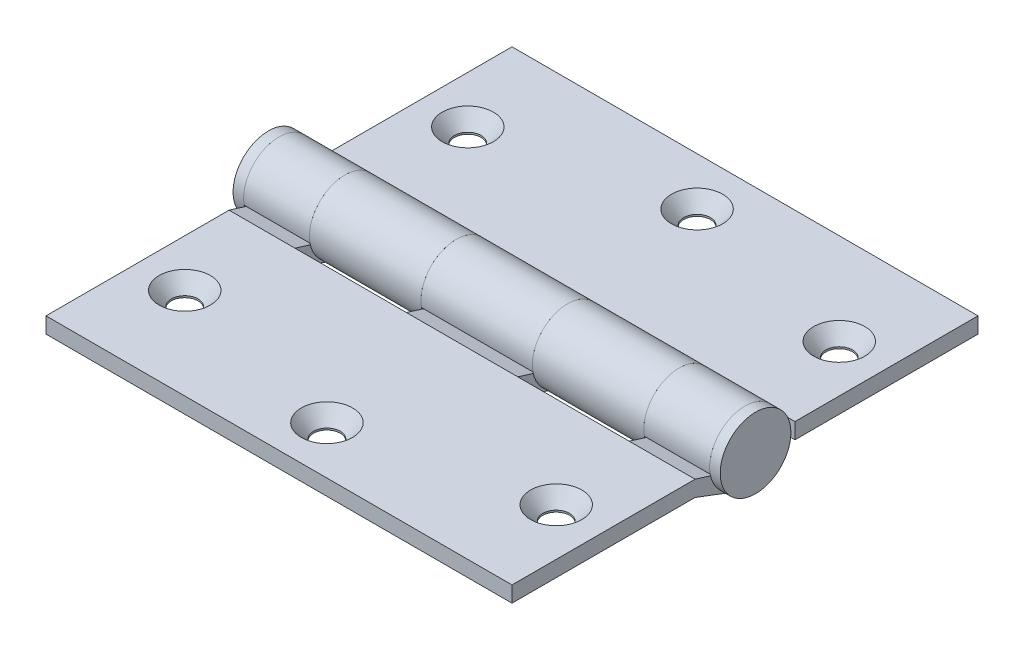
from build123d import *

# Parameters (mm, degrees)
LEFT_LEAF_DEPTH                              = 44.45
CUT_EXTRUDE1_DEPTH                           = 64.222822796
CUT_EXTRUDE1_DEPTH_BACK                      = 64.222822796
SKETCH2_W                                    = 21.2598
SKETCH2_H                                    = 16.271875
RIGHT_LEAF_DEPTH                             = 21.2598
EXTRUDE3_START                               = -44.45
SKETCH4_W                                    = 34.925
SKETCH4_H                                    = 3.0226
EXTRUDE3_DEPTH                               = 88.9
SKETCH6_W                                    = 88.9
SKETCH6_H                                    = 3.3734375
SKETCH7_W                                    = 2.015066667
SKETCH7_H                                    = 6.746875
CSK_FOR_10_FLAT_HEAD_MACHINE_SCREW1_AT_COUNT = 2
CSK_FOR_10_FLAT_HEAD_MACHINE_SCREW1_AT_PITCH = 54.0004
CSK_FOR_10_FLAT_HEAD_MACHINE_SCREW1_2_COUNT  = 2
CSK_FOR_10_FLAT_HEAD_MACHINE_SCREW1_2_PITCH  = 89.0956405
CSK_FOR_10_FLAT_HEAD_MACHINE_SCREW1_3_COUNT  = 2
CSK_FOR_10_FLAT_HEAD_MACHINE_SCREW1_3_PITCH  = 70.866
CSK_FOR_10_FLAT_HEAD_MACHINE_SCREW1_4_COUNT  = 2
CSK_FOR_10_FLAT_HEAD_MACHINE_SCREW1_4_PITCH  = 71.676774812
CSK_FOR_10_FLAT_HEAD_MACHINE_SCREW1_5_COUNT  = 2
CSK_FOR_10_FLAT_HEAD_MACHINE_SCREW1_5_PITCH  = 36.39345824


with BuildPart() as part:
    # Sketch1 → Left Leaf (new, symmetric)
    with BuildSketch(Plane(origin=(0, 0, 0), x_dir=(0, 0, -1), z_dir=(1, 0, 0))):
        with BuildLine():
            Line((-9.525, -3.6068), (-2.389867117, -6.309426078))
            ThreePointArc((-2.389867117, -6.309426078), (5.183454402, 4.318810338), (-6.637155431, -1.21181271))
            Line((-6.637155431, -1.21181271), (-2.148853245, -2.600482704))
            ThreePointArc((-2.148853245, -2.600482704), (1.603448449, 2.968001624), (-0.997099439, -3.222712099))
            Line((-0.997099439, -3.222712099), (-9.525, -0.5842))
            Line((-9.525, -0.5842), (-44.45, -0.5842))
            Line((-44.45, -0.5842), (-44.45, -3.6068))
            Line((-44.45, -3.6068), (-9.525, -3.6068))
        make_face()
    extrude(amount=LEFT_LEAF_DEPTH, both=True)

    # Sketch2 → Cut-Extrude1 (cut, two sides: drawn at the far end of the back side and taken through both)
    with BuildSketch(Plane(origin=(0, 0, 0), x_dir=(1, 0, 0), z_dir=(0, 1, 0)).offset(-CUT_EXTRUDE1_DEPTH_BACK)):
        with Locations((21.2598, -1.3890625)):
            Rectangle(SKETCH2_W, SKETCH2_H)
        with Locations((-21.2598, -1.3890625)):
            Rectangle(SKETCH2_W, SKETCH2_H)
    extrude(amount=CUT_EXTRUDE1_DEPTH + CUT_EXTRUDE1_DEPTH_BACK, mode=Mode.SUBTRACT)

    # Sketch9 → CSK for #10 Flat Head Machine Screw1 (revolve, cut)
    with BuildSketch(Plane(origin=(-35.433, -0.5842, 27.0002), x_dir=(0, 0, 1), z_dir=(1, 0, 0))):
        Polygon((0, 0), (0, 6.162675), (2.5527, 6.162675), (2.5527, 2.688180894), (4.8895, 0), align=None)
    csk_for_10_flat_head_machine_screw1 = revolve(axis=Axis((-35.433, 5.7658, 27.0002), (0, -1, 0)), mode=Mode.SUBTRACT)

    # CSK for _10 Flat Head Machine Screw1 3: CSK for #10 Flat Head Machine Screw1 ×2
    with Locations(*[(i * CSK_FOR_10_FLAT_HEAD_MACHINE_SCREW1_3_PITCH, 0, 0) for i in range(1, CSK_FOR_10_FLAT_HEAD_MACHINE_SCREW1_3_COUNT)]):
        add(csk_for_10_flat_head_machine_screw1, mode=Mode.SUBTRACT)

    # CSK for _10 Flat Head Machine Screw1 5: CSK for #10 Flat Head Machine Screw1 ×2
    with Locations(*[Vector(0.9736090416769398, 0, 0.22822233450061566) * (i * CSK_FOR_10_FLAT_HEAD_MACHINE_SCREW1_5_PITCH) for i in range(1, CSK_FOR_10_FLAT_HEAD_MACHINE_SCREW1_5_COUNT)]):
        add(csk_for_10_flat_head_machine_screw1, mode=Mode.SUBTRACT)


with BuildPart() as body_2:
    # Sketch3 → Right Leaf (new body)
    with BuildSketch(Plane(origin=(31.8897, 0, 0), x_dir=(0, 0, -1), z_dir=(1, 0, 0))):
        with BuildLine():
            Line((9.525, -3.6068), (2.389867117, -6.309426078))
            ThreePointArc((2.389867117, -6.309426078), (-5.183454402, 4.318810338), (6.637155431, -1.21181271))
            Line((6.637155431, -1.21181271), (2.148853245, -2.600482704))
            ThreePointArc((2.148853245, -2.600482704), (-1.603448449, 2.968001624), (0.997099439, -3.222712099))
            Line((0.997099439, -3.222712099), (9.525, -0.5842))
            Line((9.525, -0.5842), (44.45, -0.5842))
            Line((44.45, -0.5842), (44.45, -3.6068))
            Line((44.45, -3.6068), (9.525, -3.6068))
        make_face()
    extrude(amount=-RIGHT_LEAF_DEPTH)


with BuildPart() as body_3:
    # Mirror1: mirrored copy
    add(body_2.part.mirror(Plane(origin=(0, 0, 0), x_dir=(0, 0, 1), z_dir=(1, 0, 0))))


with BuildPart() as body_4:
    # Sketch4 → Extrude3 (new body)
    with BuildSketch(Plane.ZY.offset(EXTRUDE3_START)):
        with Locations((-26.9875, -2.0955)):
            Rectangle(SKETCH4_W, SKETCH4_H)
    extrude(amount=EXTRUDE3_DEPTH)


with BuildPart() as body_3_1:
    add(body_3.part)

    # Combine1: union body 2, body 4
    add(body_2.part)
    add(body_4.part)

    # CSK for #10 Flat Head Machine Screw1 at: CSK for #10 Flat Head Machine Screw1 ×2
    with Locations(*[(0, 0, -i * CSK_FOR_10_FLAT_HEAD_MACHINE_SCREW1_AT_PITCH) for i in range(1, CSK_FOR_10_FLAT_HEAD_MACHINE_SCREW1_AT_COUNT)]):
        add(csk_for_10_flat_head_machine_screw1, mode=Mode.SUBTRACT)

    # CSK for _10 Flat Head Machine Screw1 2: CSK for #10 Flat Head Machine Screw1 ×2
    with Locations(*[Vector(0.7953924524483951, 0, -0.6060947505036878) * (i * CSK_FOR_10_FLAT_HEAD_MACHINE_SCREW1_2_PITCH) for i in range(1, CSK_FOR_10_FLAT_HEAD_MACHINE_SCREW1_2_COUNT)]):
        add(csk_for_10_flat_head_machine_screw1, mode=Mode.SUBTRACT)

    # CSK for _10 Flat Head Machine Screw1 4: CSK for #10 Flat Head Machine Screw1 ×2
    with Locations(*[Vector(0.49434422925657207, 0, -0.8692662325206967) * (i * CSK_FOR_10_FLAT_HEAD_MACHINE_SCREW1_4_PITCH) for i in range(1, CSK_FOR_10_FLAT_HEAD_MACHINE_SCREW1_4_COUNT)]):
        add(csk_for_10_flat_head_machine_screw1, mode=Mode.SUBTRACT)


with BuildPart() as body_3_2:
    # Sketch6 → Pin (revolve)
    with BuildSketch(Plane(origin=(0, 0, 0), x_dir=(1, 0, 0), z_dir=(0, 1, 0)), mode=Mode.PRIVATE) as pin_sk:
        with Locations((0, -1.68671875)):
            Rectangle(SKETCH6_W, SKETCH6_H)
    revolve(pin_sk.sketch.rotate(Axis((24.566181471, 0, 0), (-1, 0, 0)), 180), axis=Axis((24.566181471, 0, 0), (-1, 0, 0)))

    # Sketch7 → Spun Pin (revolve)
    with BuildSketch(Plane(origin=(0, 0, 0), x_dir=(1, 0, 0), z_dir=(0, 1, 0)), mode=Mode.PRIVATE) as spun_pin_sk:
        with Locations((-45.457533334, -3.3734375)):
            Rectangle(SKETCH7_W, SKETCH7_H)
        with Locations((45.457533334, -3.3734375)):
            Rectangle(SKETCH7_W, SKETCH7_H)
    revolve(spun_pin_sk.sketch.rotate(Axis((24.566181471, 0, 0), (-1, 0, 0)), 180), axis=Axis((24.566181471, 0, 0), (-1, 0, 0)))


solid = Compound([part.part, body_3_1.part, body_3_2.part])
